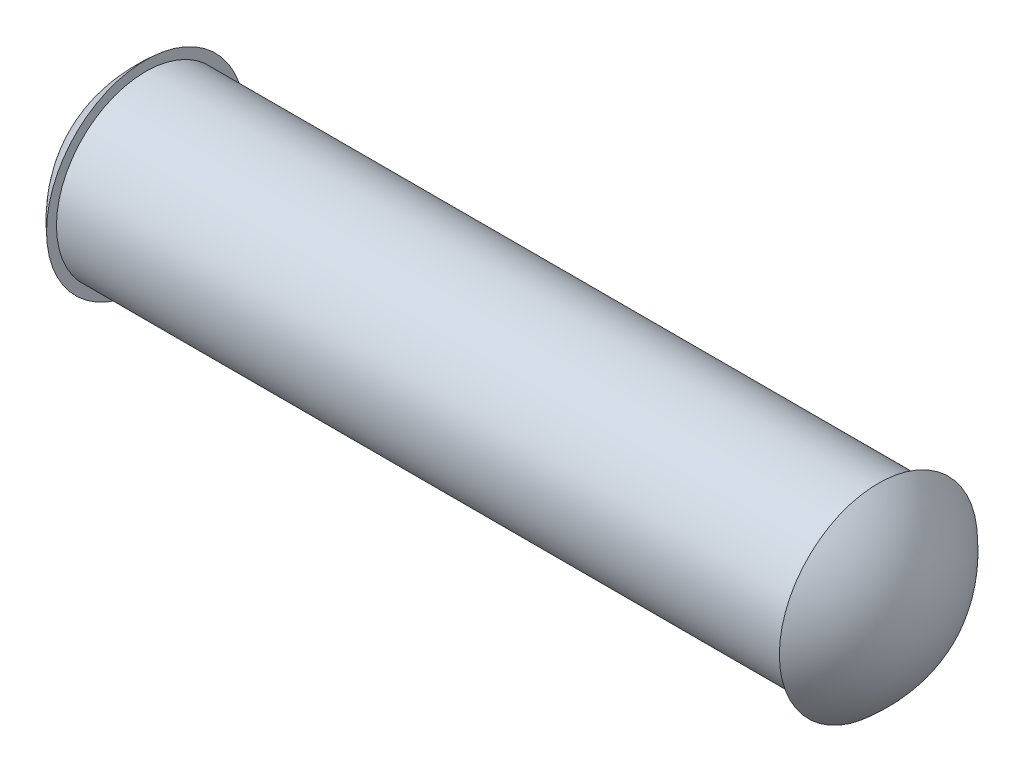
from build123d import *

# Parameters (mm, degrees)
BOSS_EXTRUDE1_DEPTH      = 9.398
BOSS_EXTRUDE1_DEPTH_BACK = 9.398
SKETCH1_R                = 2.286


with BuildPart() as part:
    # Sketch1 → Boss-Extrude1 (new, two sides: drawn at the far end of the back side and taken through both)
    with BuildSketch(Plane(origin=(0, 0, 0), x_dir=(0, 0, -1), z_dir=(1, 0, 0)).offset(-BOSS_EXTRUDE1_DEPTH_BACK)):
        Circle(SKETCH1_R)
    extrude(amount=BOSS_EXTRUDE1_DEPTH + BOSS_EXTRUDE1_DEPTH_BACK)

    # Sketch5 → Revolve1 (revolve)
    with BuildSketch(Plane(origin=(0, 0, 0), x_dir=(1, 0, 0), z_dir=(0, 1, 0))):
        with BuildLine():
            Line((9.398, 0), (9.398, 2.54))
            add(Edge.make_bspline(
                [(9.398, 2.54), (10.668, 1.419903166), (10.668, 0)],
                knots=[0, 0, 0, 1, 1, 1], degree=2))
            Line((10.668, 0), (9.398, 0))
        make_face()
    revolve1 = revolve(axis=Axis((9.398, 0, 0), (1, 0, 0)))

    # Mirror1: Revolve1 across plane
    add(revolve1.mirror(Plane(origin=(0, 0, 0), x_dir=(0, 0, 1), z_dir=(1, 0, 0))))


solid = part.part
